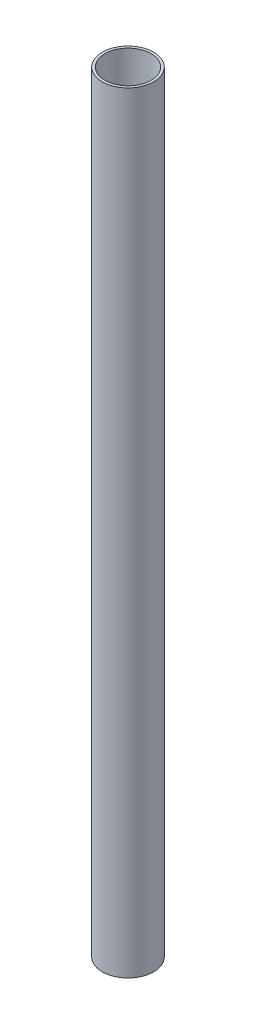
from build123d import *

# Parameters (mm, degrees)
SKETCH_1_R   = 10
SKETCH_1_R_2 = 9
F_1MM_DEPTH  = 150


with BuildPart() as part:
    # 草图1 → 1mm (new, symmetric)
    with BuildSketch(Plane(origin=(0, 0, 0), x_dir=(1, 0, 0), z_dir=(0, 1, 0))):
        Circle(SKETCH_1_R)
        Circle(SKETCH_1_R_2, mode=Mode.SUBTRACT)
    extrude(amount=F_1MM_DEPTH, both=True)


solid = part.part
